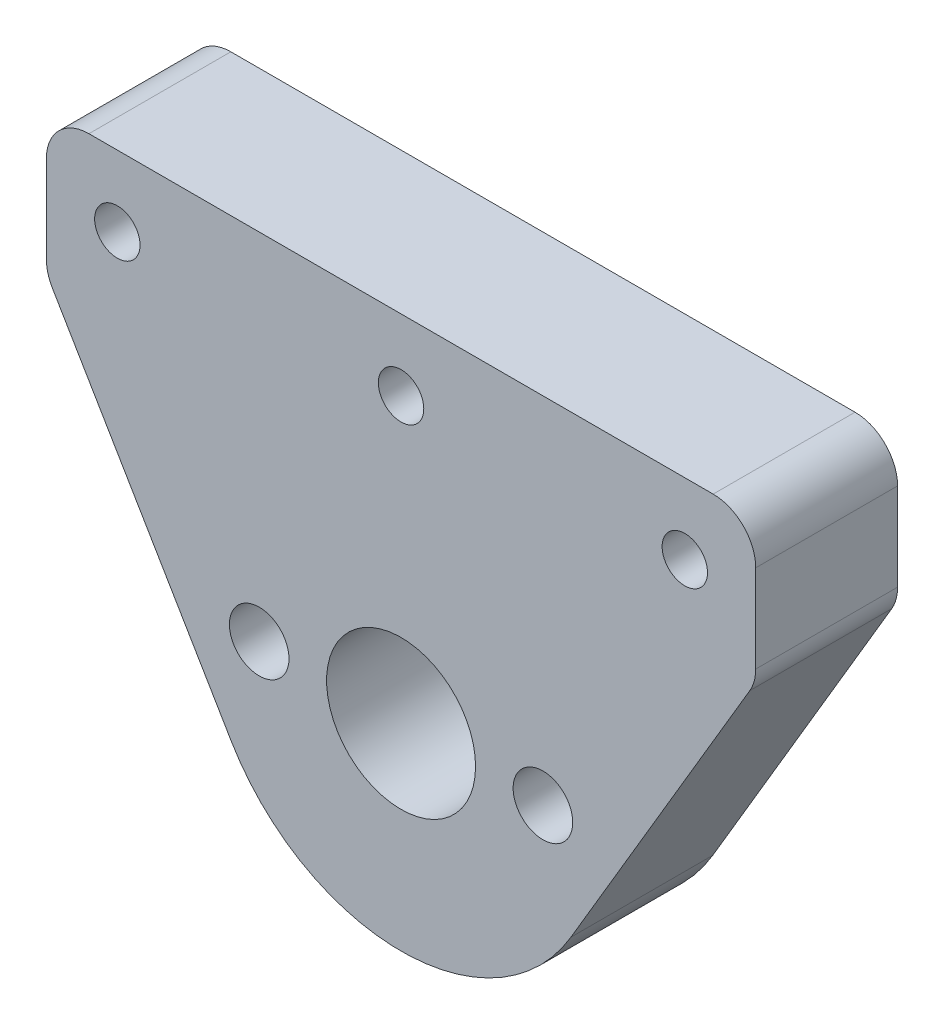
from build123d import *

# Parameters (mm, degrees)
SKETCH_1_R          = 13.9
SKETCH_1_R_2        = 2.1
SKETCH_1_W          = 50
SKETCH_1_H          = 10
SKETCH_1_R_3        = 1.6
EXTRUDE_1_DEPTH     = 10
FILLET_1_R          = 3
CUT_EXTRUDE_1_DEPTH = 10


with BuildPart() as part:
    # ｽｹｯﾁ1 → ﾎﾞｽ - 押し出し1 (new body)
    # profile 1 of 3: a face of its own
    with BuildSketch(Plane.XY):
        with Locations((0, -20)):
            Circle(SKETCH_1_R)
        with Locations((-10, -20)):
            Circle(SKETCH_1_R_2, mode=Mode.SUBTRACT)
        with Locations((10, -20)):
            Circle(SKETCH_1_R_2, mode=Mode.SUBTRACT)
    # profile 2 of 3: a face of its own
    with BuildSketch(Plane.XY):
        with BuildLine():
            Line((25, -5), (-25, -5))
            Line((-25, -5), (-11.969023725, -27.067706209))
            ThreePointArc((-11.969023725, -27.067706209), (-3.66337073, -6.591431288), (13.9, -20))
            ThreePointArc((13.9, -20), (13.408568712, -23.66337073), (11.969023725, -27.067706209))
            Line((11.969023725, -27.067706209), (25, -5))
        make_face()
    # profile 3 of 3: a face of its own
    with BuildSketch(Plane.XY):
        Rectangle(SKETCH_1_W, SKETCH_1_H)
        Circle(SKETCH_1_R_3, mode=Mode.SUBTRACT)
        with Locations((-20, 0)):
            Circle(SKETCH_1_R_3, mode=Mode.SUBTRACT)
        with Locations((20, 0)):
            Circle(SKETCH_1_R_3, mode=Mode.SUBTRACT)
    extrude(amount=EXTRUDE_1_DEPTH)

    # ﾌｨﾚｯﾄ1
    fillet_1_edges = [part.edges().sort_by_distance(p)[0] for p in [
        (-25, -5, 5),
        (-25, 5, 5),
        (25, 5, 5),
        (25, -5, 5),
    ]]
    fillet(fillet_1_edges, radius=FILLET_1_R)

    # ｽｹｯﾁ2 → ｶｯﾄ - 押し出し1 (cut)
    with BuildSketch(Plane.XY.offset(10)):
        with BuildLine():
            ThreePointArc((5.25, -20), (0, -14.75), (-5.25, -20))
            Line((-5.25, -20), (5.25, -20))
        make_face()
        with BuildLine():
            Line((5.25, -20), (-5.25, -20))
            ThreePointArc((-5.25, -20), (0, -25.25), (5.25, -20))
        make_face()
    extrude(amount=-CUT_EXTRUDE_1_DEPTH, mode=Mode.SUBTRACT)


solid = part.part
